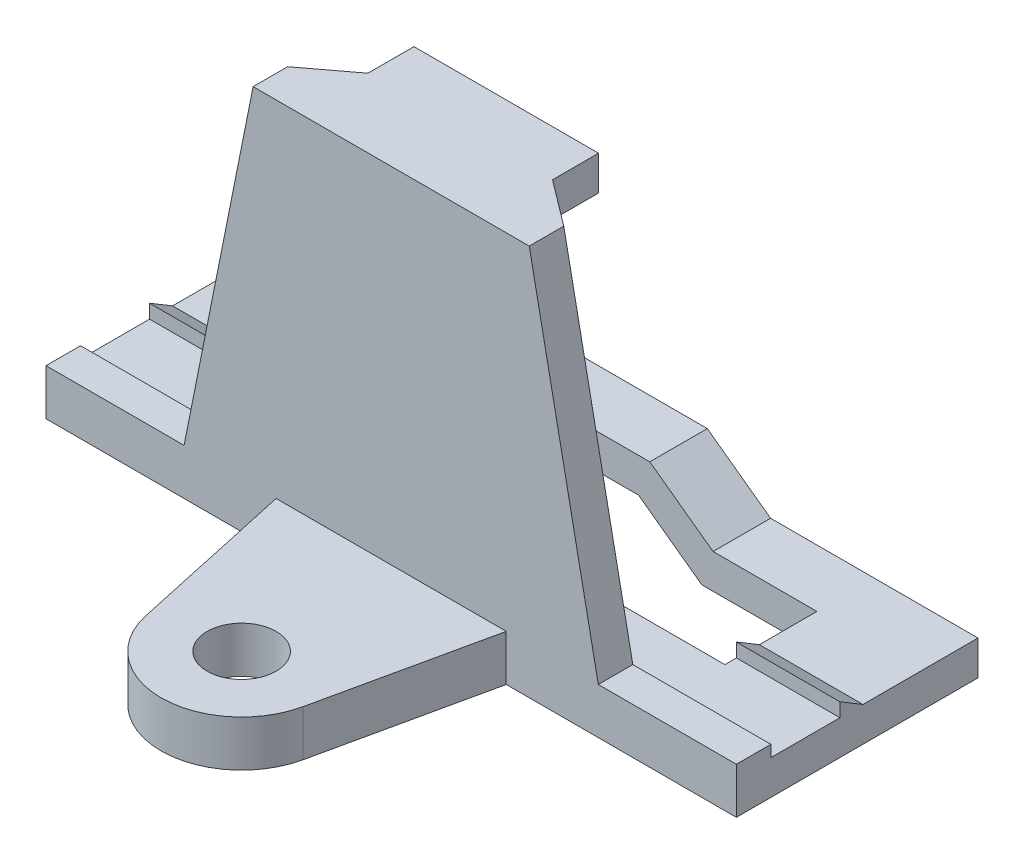
from build123d import *

# Parameters (mm, degrees)
SALIENTE_EXTRUIR1_DEPTH = 1.5
CROQUIS2_W              = 10
CROQUIS2_H              = 2
SALIENTE_EXTRUIR2_DEPTH = 10
CROQUIS3_R              = 1.5
CORTAR_EXTRUIR1_DEPTH   = 10
SALIENTE_EXTRUIR5_DEPTH = 1.5
SALIENTE_EXTRUIR6_DEPTH = 1.5
REDONDEO2_R             = 1
SALIENTE_EXTRUIR7_DEPTH = 9
CORTAR_EXTRUIR2_REACH   = 27.421
CROQUIS8_W              = 21
CROQUIS8_H              = 4
SALIENTE_EXTRUIR8_DEPTH = 4.5
SALIENTE_EXTRUIR9_DEPTH = 4.5


with BuildPart() as part:
    # Croquis1 → Saliente-Extruir1 (new body)
    with BuildSketch(Plane.XY):
        Polygon((-6, 8.5), (6, 8.5), (9, -6.5), (15, -6.5), (15, -8.5), (-15, -8.5), (-15, -6.5), (-9, -6.5), align=None)
    extrude(amount=SALIENTE_EXTRUIR1_DEPTH)

    # Croquis2 → Saliente-Extruir2 (add)
    with BuildSketch(Plane.XY.offset(1.5)):
        with Locations((0, -7.5)):
            Rectangle(CROQUIS2_W, CROQUIS2_H)
    extrude(amount=SALIENTE_EXTRUIR2_DEPTH)

    # Croquis3 → Cortar-Extruir1 (cut)
    with BuildSketch(Plane.XZ.offset(8.5)):
        with BuildLine():
            Line((-5, 11.5), (-5, 1.5))
            Line((-5, 1.5), (-3.41960618, 8.745850907))
            ThreePointArc((-3.41960618, 8.745850907), (-2.195395389, 10.72584649), (0, 11.5))
            Line((0, 11.5), (-5, 11.5))
        make_face()
        with BuildLine():
            Line((5, 11.5), (0, 11.5))
            ThreePointArc((0, 11.5), (2.195395389, 10.72584649), (3.41960618, 8.745850907))
            Line((3.41960618, 8.745850907), (5, 1.5))
            Line((5, 1.5), (5, 11.5))
        make_face()
        with Locations(Location((0, 8, 0), (0, 0, 270))):
            Circle(CROQUIS3_R)
    extrude(amount=-CORTAR_EXTRUIR1_DEPTH, mode=Mode.SUBTRACT)

    # Croquis4 → Saliente-Extruir5 (add)
    with BuildSketch(Plane(origin=(0, 8.5, 0), x_dir=(1, 0, 0), z_dir=(0, 1, 0))):
        Polygon((6, 0), (4.010944544, 1.5), (4.010944544, 3.5), (-4.010944544, 3.5), (-4.010944544, 1.5), (-6, 0), align=None)
    extrude(amount=-SALIENTE_EXTRUIR5_DEPTH)

    # Croquis6 → Saliente-Extruir6 (add)
    with BuildSketch(Plane(origin=(0, 0, -3.5), x_dir=(-1, 0, 0), z_dir=(0, 0, -1))):
        Polygon((-4.010944544, 7), (0, 4.5), (4.010944544, 7), align=None)
    extrude(amount=-SALIENTE_EXTRUIR6_DEPTH)

    # Redondeo2
    redondeo2_edges = [part.edges().sort_by_distance(p)[0] for p in [
        (0, 4.5, -2.75),
    ]]
    fillet(redondeo2_edges, radius=REDONDEO2_R)

    # Croquis7 → Saliente-Extruir7 (add)
    with BuildSketch(Plane(origin=(0, 0, 0), x_dir=(-1, 0, 0), z_dir=(0, 0, -1))):
        Polygon((5.5, -8.5), (15, -8.5), (15, -7), (5.98777572, -7), (3.23777572, -5), (-3.23777572, -5), (-5.98777572, -7), (-15, -7), (-15, -8.5), (-5.5, -8.5), (-2.75, -6.5), (2.75, -6.5), align=None)
    extrude(amount=SALIENTE_EXTRUIR7_DEPTH)

    # Croquis8 → Cortar-Extruir2 (cut, up to next)
    with BuildSketch(Plane.XZ.offset(8.5), mode=Mode.PRIVATE) as cortar_extruir2_sk1:
        with Locations((0, -4.5)):
            Rectangle(CROQUIS8_W, CROQUIS8_H)
    cortar_extruir2_tool1 = extrude(cortar_extruir2_sk1.sketch, amount=-CORTAR_EXTRUIR2_REACH, mode=Mode.PRIVATE) & part.part
    add(cortar_extruir2_tool1.solids().sort_by_distance((0, -8.5, -4.5))[0], mode=Mode.SUBTRACT)

    # Croquis9 → Saliente-Extruir8 (add)
    with BuildSketch(Plane(origin=(15, 0, 0), x_dir=(0, 0, -1), z_dir=(1, 0, 0))):
        Polygon((3, -7), (3, -6.4), (4, -7), align=None)
    extrude(amount=-SALIENTE_EXTRUIR8_DEPTH)

    # Croquis10 → Saliente-Extruir9 (add)
    with BuildSketch(Plane.ZY.offset(15)):
        Polygon((-3, -6.4), (-3, -7), (-4, -7), align=None)
    extrude(amount=-SALIENTE_EXTRUIR9_DEPTH)


solid = part.part
